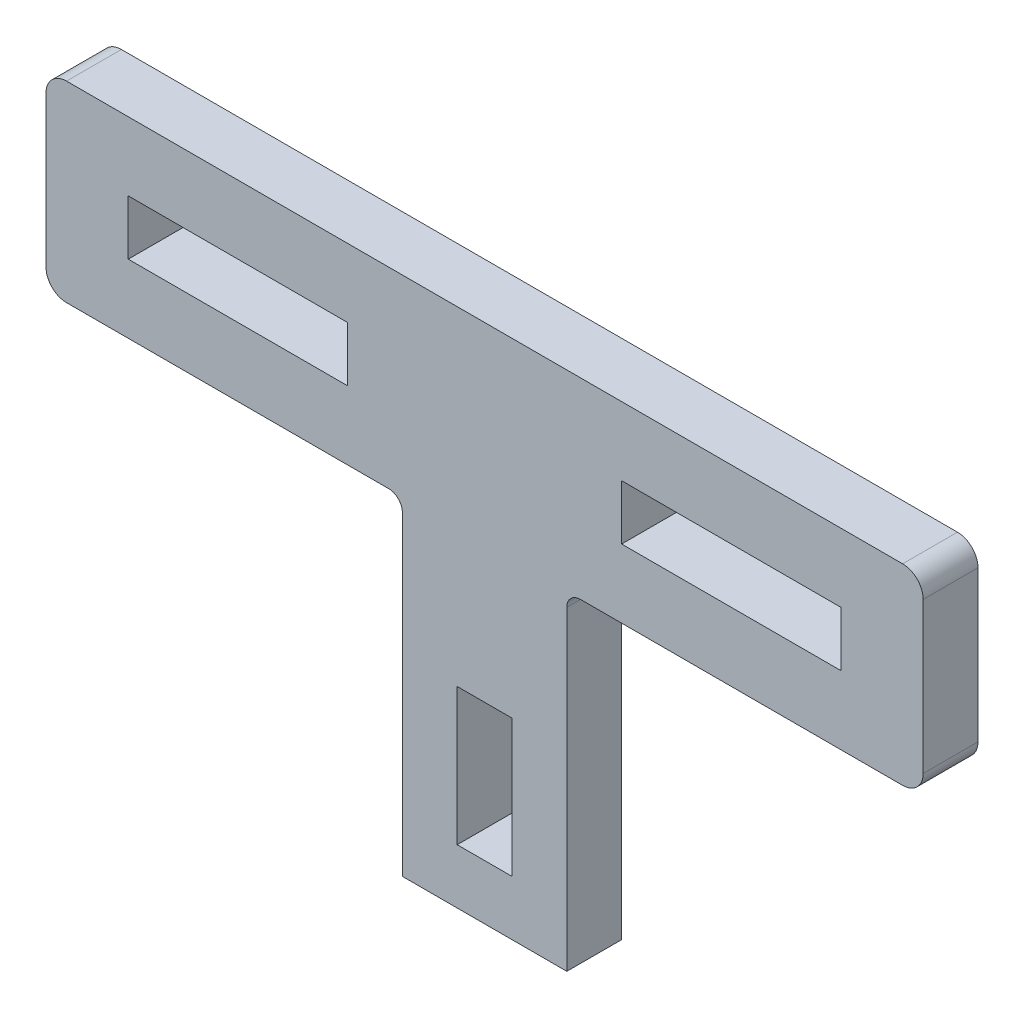
from build123d import *

# Parameters (mm, degrees)
SKETCH1_W           = 8
SKETCH1_H           = 2
SKETCH1_W_2         = 2
SKETCH1_H_2         = 5
BOSS_EXTRUDE1_DEPTH = 2


with BuildPart() as part:
    # Sketch1 → Boss-Extrude1 (new body)
    with BuildSketch(Plane.XY):
        with BuildLine():
            Line((15.25, 3.5), (-15.25, 3.5))
            ThreePointArc((-15.25, 3.5), (-15.780330086, 3.280330086), (-16, 2.75))
            Line((-16, 2.75), (-16, -2.75))
            ThreePointArc((-16, -2.75), (-15.780330086, -3.280330086), (-15.25, -3.5))
            Line((-15.25, -3.5), (-3.5, -3.5))
            ThreePointArc((-3.5, -3.5), (-3.146446609, -3.646446609), (-3, -4))
            Line((-3, -4), (-3, -15.5))
            Line((-3, -15.5), (3, -15.5))
            Line((3, -15.5), (3, -4))
            ThreePointArc((3, -4), (3.146446609, -3.646446609), (3.5, -3.5))
            Line((3.5, -3.5), (15.25, -3.5))
            ThreePointArc((15.25, -3.5), (15.780330086, -3.280330086), (16, -2.75))
            Line((16, -2.75), (16, 2.75))
            ThreePointArc((16, 2.75), (15.780330086, 3.280330086), (15.25, 3.5))
        make_face()
        with Locations((-9, 0)):
            Rectangle(SKETCH1_W, SKETCH1_H, mode=Mode.SUBTRACT)
        with Locations((9, 0)):
            Rectangle(SKETCH1_W, SKETCH1_H, mode=Mode.SUBTRACT)
        with Locations((0, -11)):
            Rectangle(SKETCH1_W_2, SKETCH1_H_2, mode=Mode.SUBTRACT)
    extrude(amount=BOSS_EXTRUDE1_DEPTH)


solid = part.part
